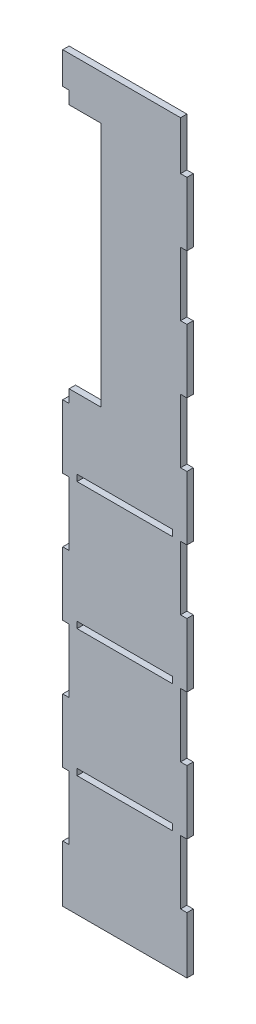
from build123d import *

# Parameters (mm, degrees)
SKETCH_1_W      = 30
SKETCH_1_H      = 2
EXTRUDE_2_DEPTH = 2


with BuildPart() as part:
    # 草图1 → 凸台-拉伸2 (new body)
    with BuildSketch(Plane.XY):
        Polygon((-8, -36.22154055), (-10, -36.22154055), (-10, -56.22154055), (-8, -56.22154055), (-8, -76.22154055), (-10, -76.22154055), (-10, -96.22154055), (-8, -96.22154055), (-8, -116.22154055), (-10, -116.22154055), (-10, -136.22154055), (-8, -136.22154055), (-8, -156.22154055), (-10, -156.22154055), (-10, -174), (-8, -174), (27, -174), (29, -174), (29, -156.22154055), (27, -156.22154055), (27, -136.22154055), (29, -136.22154055), (29, -116.22154055), (27, -116.22154055), (27, -96.22154055), (29, -96.22154055), (29, -76.22154055), (27, -76.22154055), (27, -56.22154055), (29, -56.22154055), (29, -36.22154055), (27, -36.22154055), (27, -16.22154055), (29, -16.22154055), (29, 3.77845945), (27, 3.77845945), (27, 23.77845945), (29, 23.77845945), (29, 43.77845945), (27, 43.77845945), (27, 49), (27, 59), (-10, 59), (-10, 49), (-8, 49), (-8, 45), (2, 45), (2, 43.34252786), (2, 15.14100393), (2, -15.14100393), (2, -31.22154055), (2, -32.22154055), (-8, -32.22154055), align=None)
        with Locations((9.5, -95.22154055)):
            Rectangle(SKETCH_1_W, SKETCH_1_H, mode=Mode.SUBTRACT)
        with Locations((9.5, -135.22154055)):
            Rectangle(SKETCH_1_W, SKETCH_1_H, mode=Mode.SUBTRACT)
        with Locations((9.5, -55.22154055)):
            Rectangle(SKETCH_1_W, SKETCH_1_H, mode=Mode.SUBTRACT)
    extrude(amount=EXTRUDE_2_DEPTH)


solid = part.part
